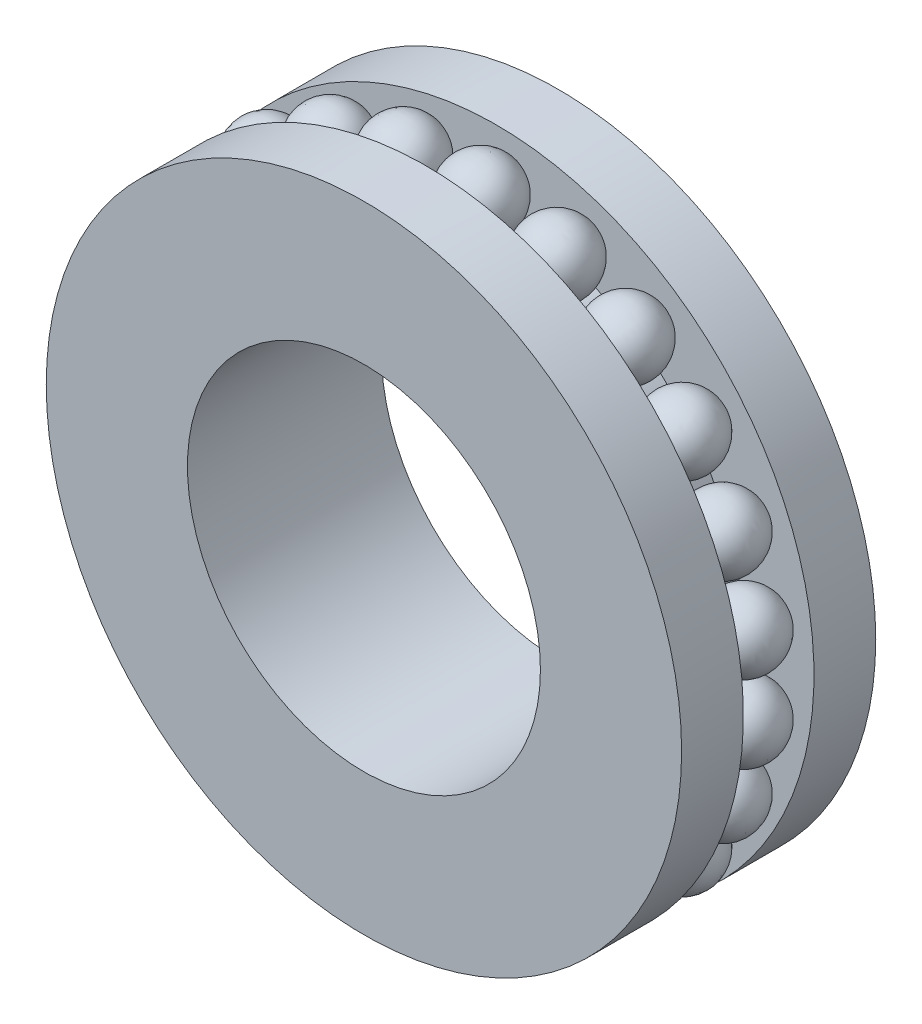
from build123d import *

# Parameters (mm, degrees)
SKETCH_1_R               = 9
SKETCH_1_R_2             = 5
EXTRUDE_1_DEPTH          = 5.5
CUT_EXTRUDE_1_DEPTH      = 1
CUT_EXTRUDE_1_DEPTH_BACK = 1
SKETCH_2_R               = 9
SKETCH_2_R_2             = 7
PATTERN_CIRCULAR_4_COUNT = 23


with BuildPart() as part:
    # 草图1 → 凸台-拉伸1 (new body)
    with BuildSketch(Plane.XY):
        Circle(SKETCH_1_R)
        Circle(SKETCH_1_R_2, mode=Mode.SUBTRACT)
    extrude(amount=EXTRUDE_1_DEPTH)

    # 草图2 → 切除-拉伸1 (cut, two sides: drawn at the far end of the back side and taken through both)
    with BuildSketch(Plane(origin=(0, 0, 2.75), x_dir=(-1, 0, 0), z_dir=(0, 0, -1)).offset(-CUT_EXTRUDE_1_DEPTH_BACK)):
        Circle(SKETCH_2_R)
        Circle(SKETCH_2_R_2, mode=Mode.SUBTRACT)
    extrude(amount=CUT_EXTRUDE_1_DEPTH + CUT_EXTRUDE_1_DEPTH_BACK, mode=Mode.SUBTRACT)


with BuildPart() as body_2:
    # 草图3 → 旋转3 (revolve)
    with BuildSketch(Plane(origin=(0, 0, 0), x_dir=(1, 0, 0), z_dir=(0, 1, 0))):
        with BuildLine():
            Line((-8.073608321, -3.75), (-8.073608321, -1.75))
            ThreePointArc((-8.073608321, -1.75), (-9.073608321, -2.75), (-8.073608321, -3.75))
        make_face()
    revolve(axis=Axis((-8.073608321, 0, 3.75), (0, 0, -1)))


with BuildPart() as pattern_circular_4_1:
    # 阵列(圆周)4: pattern copy
    add(body_2.part.rotate(Axis((0, 0, 5.5), (0, 0, -1)), 1 * 360 / PATTERN_CIRCULAR_4_COUNT))


with BuildPart() as pattern_circular_4_2:
    # 阵列(圆周)4: pattern copy
    add(body_2.part.rotate(Axis((0, 0, 5.5), (0, 0, -1)), 2 * 360 / PATTERN_CIRCULAR_4_COUNT))


with BuildPart() as pattern_circular_4_3:
    # 阵列(圆周)4: pattern copy
    add(body_2.part.rotate(Axis((0, 0, 5.5), (0, 0, -1)), 3 * 360 / PATTERN_CIRCULAR_4_COUNT))


with BuildPart() as pattern_circular_4_4:
    # 阵列(圆周)4: pattern copy
    add(body_2.part.rotate(Axis((0, 0, 5.5), (0, 0, -1)), 4 * 360 / PATTERN_CIRCULAR_4_COUNT))


with BuildPart() as pattern_circular_4_5:
    # 阵列(圆周)4: pattern copy
    add(body_2.part.rotate(Axis((0, 0, 5.5), (0, 0, -1)), 5 * 360 / PATTERN_CIRCULAR_4_COUNT))


with BuildPart() as pattern_circular_4_6:
    # 阵列(圆周)4: pattern copy
    add(body_2.part.rotate(Axis((0, 0, 5.5), (0, 0, -1)), 6 * 360 / PATTERN_CIRCULAR_4_COUNT))


with BuildPart() as pattern_circular_4_7:
    # 阵列(圆周)4: pattern copy
    add(body_2.part.rotate(Axis((0, 0, 5.5), (0, 0, -1)), 7 * 360 / PATTERN_CIRCULAR_4_COUNT))


with BuildPart() as pattern_circular_4_8:
    # 阵列(圆周)4: pattern copy
    add(body_2.part.rotate(Axis((0, 0, 5.5), (0, 0, -1)), 8 * 360 / PATTERN_CIRCULAR_4_COUNT))


with BuildPart() as pattern_circular_4_9:
    # 阵列(圆周)4: pattern copy
    add(body_2.part.rotate(Axis((0, 0, 5.5), (0, 0, -1)), 9 * 360 / PATTERN_CIRCULAR_4_COUNT))


with BuildPart() as pattern_circular_4_10:
    # 阵列(圆周)4: pattern copy
    add(body_2.part.rotate(Axis((0, 0, 5.5), (0, 0, -1)), 10 * 360 / PATTERN_CIRCULAR_4_COUNT))


with BuildPart() as pattern_circular_4_11:
    # 阵列(圆周)4: pattern copy
    add(body_2.part.rotate(Axis((0, 0, 5.5), (0, 0, -1)), 11 * 360 / PATTERN_CIRCULAR_4_COUNT))


with BuildPart() as pattern_circular_4_12:
    # 阵列(圆周)4: pattern copy
    add(body_2.part.rotate(Axis((0, 0, 5.5), (0, 0, -1)), 12 * 360 / PATTERN_CIRCULAR_4_COUNT))


with BuildPart() as pattern_circular_4_13:
    # 阵列(圆周)4: pattern copy
    add(body_2.part.rotate(Axis((0, 0, 5.5), (0, 0, -1)), 13 * 360 / PATTERN_CIRCULAR_4_COUNT))


with BuildPart() as pattern_circular_4_14:
    # 阵列(圆周)4: pattern copy
    add(body_2.part.rotate(Axis((0, 0, 5.5), (0, 0, -1)), 14 * 360 / PATTERN_CIRCULAR_4_COUNT))


with BuildPart() as pattern_circular_4_15:
    # 阵列(圆周)4: pattern copy
    add(body_2.part.rotate(Axis((0, 0, 5.5), (0, 0, -1)), 15 * 360 / PATTERN_CIRCULAR_4_COUNT))


with BuildPart() as pattern_circular_4_16:
    # 阵列(圆周)4: pattern copy
    add(body_2.part.rotate(Axis((0, 0, 5.5), (0, 0, -1)), 16 * 360 / PATTERN_CIRCULAR_4_COUNT))


with BuildPart() as pattern_circular_4_17:
    # 阵列(圆周)4: pattern copy
    add(body_2.part.rotate(Axis((0, 0, 5.5), (0, 0, -1)), 17 * 360 / PATTERN_CIRCULAR_4_COUNT))


with BuildPart() as pattern_circular_4_18:
    # 阵列(圆周)4: pattern copy
    add(body_2.part.rotate(Axis((0, 0, 5.5), (0, 0, -1)), 18 * 360 / PATTERN_CIRCULAR_4_COUNT))


with BuildPart() as pattern_circular_4_19:
    # 阵列(圆周)4: pattern copy
    add(body_2.part.rotate(Axis((0, 0, 5.5), (0, 0, -1)), 19 * 360 / PATTERN_CIRCULAR_4_COUNT))


with BuildPart() as pattern_circular_4_20:
    # 阵列(圆周)4: pattern copy
    add(body_2.part.rotate(Axis((0, 0, 5.5), (0, 0, -1)), 20 * 360 / PATTERN_CIRCULAR_4_COUNT))


with BuildPart() as pattern_circular_4_21:
    # 阵列(圆周)4: pattern copy
    add(body_2.part.rotate(Axis((0, 0, 5.5), (0, 0, -1)), 21 * 360 / PATTERN_CIRCULAR_4_COUNT))


with BuildPart() as pattern_circular_4_22:
    # 阵列(圆周)4: pattern copy
    add(body_2.part.rotate(Axis((0, 0, 5.5), (0, 0, -1)), 22 * 360 / PATTERN_CIRCULAR_4_COUNT))


solid = Compound([part.part, body_2.part, pattern_circular_4_1.part, pattern_circular_4_2.part, pattern_circular_4_3.part, pattern_circular_4_4.part, pattern_circular_4_5.part, pattern_circular_4_6.part, pattern_circular_4_7.part, pattern_circular_4_8.part, pattern_circular_4_9.part, pattern_circular_4_10.part, pattern_circular_4_11.part, pattern_circular_4_12.part, pattern_circular_4_13.part, pattern_circular_4_14.part, pattern_circular_4_15.part, pattern_circular_4_16.part, pattern_circular_4_17.part, pattern_circular_4_18.part, pattern_circular_4_19.part, pattern_circular_4_20.part, pattern_circular_4_21.part, pattern_circular_4_22.part])
